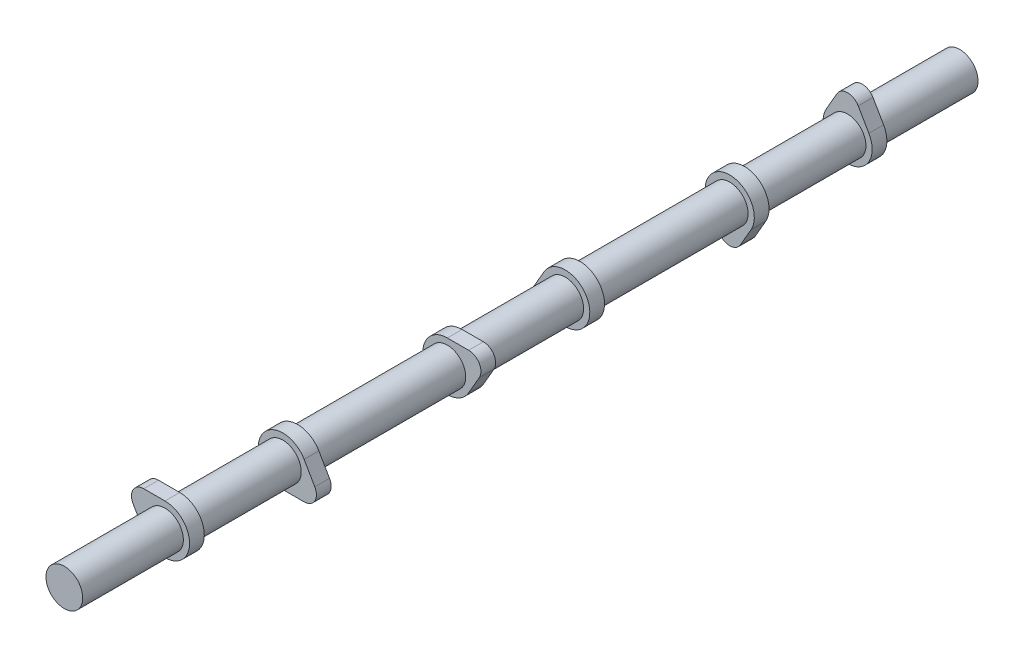
from build123d import *

# Parameters (mm, degrees)
BOSS_EXTRUDE1_DEPTH   = 7.62
BODY_MOVE_COPY2_ANGLE = 180
BOSS_EXTRUDE2_START   = -25.4
SKETCH2_R             = 9.5
BOSS_EXTRUDE2_DEPTH   = 146.05
LPATTERN1_COUNT       = 3
LPATTERN1_PITCH       = 146.05
BODY_MOVE_COPY3_ANGLE = 120
BODY_MOVE_COPY4_ANGLE = 120
BOSS_EXTRUDE3_START   = 24.94
SKETCH3_R             = 9.5
BOSS_EXTRUDE3_DEPTH   = 24.94


with BuildPart() as part:
    # Sketch1 → Boss-Extrude1 (new body)
    with BuildSketch(Plane.XY):
        with BuildLine():
            Line((-5.499261314, 15.875), (-10.998522628, 6.35))
            ThreePointArc((-10.998522628, 6.35), (0, -12.7), (10.998522628, 6.35))
            Line((10.998522628, 6.35), (5.499261314, 15.875))
            ThreePointArc((5.499261314, 15.875), (0, 19.05), (-5.499261314, 15.875))
        make_face()
    extrude(amount=BOSS_EXTRUDE1_DEPTH)


with BuildPart() as body_2:
    # Body-Move/Copy1: copy of part
    add(part.part.moved(Location((0, 0, 60.96))))


with BuildPart() as body_2_1:
    # Body-Move/Copy2: moved
    add(body_2.part.rotate(Axis((0, 0, 0), (0, 0, 1)), BODY_MOVE_COPY2_ANGLE))


with BuildPart() as part_1:
    add(part.part)

    add(body_2_1.part)  # Boss-Extrude2 merges body 2
    # Sketch2 → Boss-Extrude2 (add)
    with BuildSketch(Plane.XY.offset(BOSS_EXTRUDE2_START)):
        Circle(SKETCH2_R)
    extrude(amount=BOSS_EXTRUDE2_DEPTH)


with BuildPart() as lpattern1_1:
    # LPattern1: pattern copy
    add(part_1.part.moved(Location(Vector(0, 0, -1) * (1 * LPATTERN1_PITCH))))


with BuildPart() as lpattern1_2:
    # LPattern1: pattern copy
    add(part_1.part.moved(Location(Vector(0, 0, -1) * (2 * LPATTERN1_PITCH))))

    # Sketch3 → Boss-Extrude3 (add)
    with BuildSketch(Plane(origin=(0, 0, -317.5), x_dir=(-1, 0, 0), z_dir=(0, 0, -1)).offset(BOSS_EXTRUDE3_START)):
        Circle(SKETCH3_R)
    extrude(amount=-BOSS_EXTRUDE3_DEPTH)


with BuildPart() as lpattern1_1_1:
    # Body-Move/Copy3: moved
    add(lpattern1_1.part.rotate(Axis((0, 0, 0), (0, 0, 1)), BODY_MOVE_COPY3_ANGLE))


with BuildPart() as part_2:
    # Body-Move/Copy4: moved
    add(part_1.part.rotate(Axis((0, 0, 0), (0, 0, -1)), BODY_MOVE_COPY4_ANGLE))

    # Combine1: union LPattern1_1, LPattern1_2
    add(lpattern1_1_1.part)
    add(lpattern1_2.part)


solid = part_2.part
